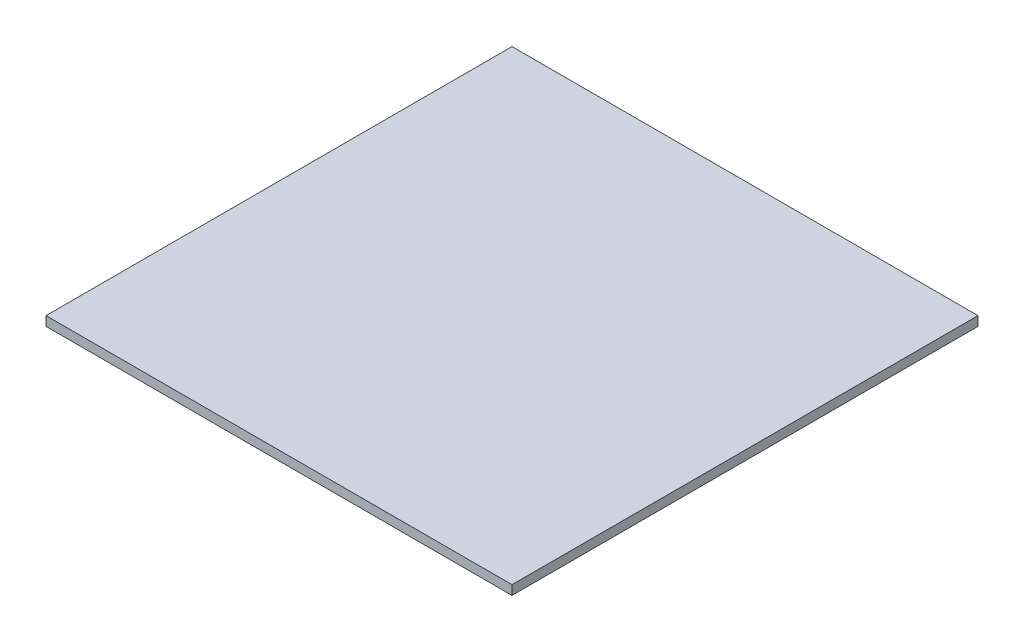
from build123d import *

# Parameters (mm, degrees)
CROQUIS1_W              = 500
CROQUIS1_H              = 500
SALIENTE_EXTRUIR1_DEPTH = 10


with BuildPart() as part:
    # Croquis1 → Saliente-Extruir1 (new body)
    with BuildSketch(Plane(origin=(0, 0, 0), x_dir=(1, 0, 0), z_dir=(0, 1, 0))):
        Rectangle(CROQUIS1_W, CROQUIS1_H)
    extrude(amount=SALIENTE_EXTRUIR1_DEPTH)


solid = part.part
